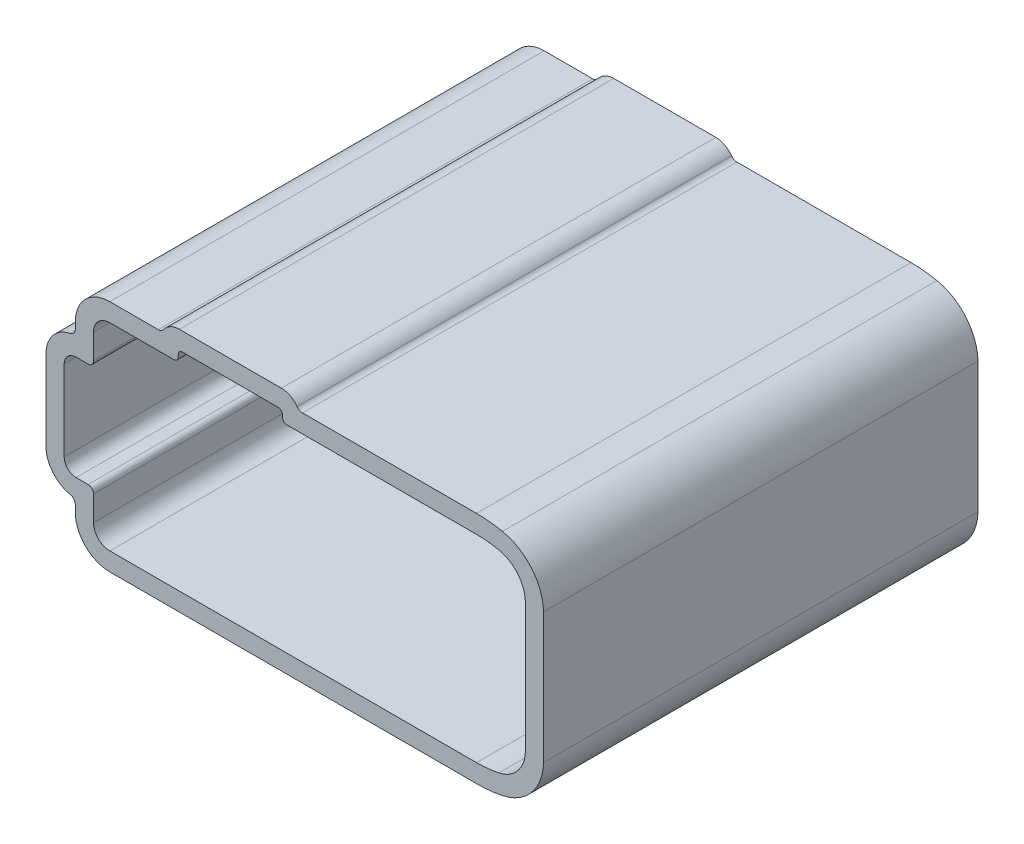
from build123d import *

# Parameters (mm, degrees)
BOSS_EXTRUDE1_DEPTH = 50.8
FILLET1_R           = 0.762


with BuildPart() as part:
    # Sketch1 → Boss-Extrude1 (new body)
    with BuildSketch(Plane.XY):
        with BuildLine():
            Line((0.921, -2.954280738), (0.921, -1.524))
            ThreePointArc((0.921, -1.524), (2.101945458, 1.327054542), (4.953, 2.508))
            Line((4.953, 2.508), (11.053129195, 2.508))
            ThreePointArc((11.053129195, 2.508), (11.884634671, 3.434294742), (13.081, 3.778))
            Line((13.081, 3.778), (25.019, 3.778))
            ThreePointArc((25.019, 3.778), (26.215365329, 3.434294742), (27.046870805, 2.508))
            Line((27.046870805, 2.508), (47.830933704, 2.508))
            ThreePointArc((47.830933704, 2.508), (49.356721017, 2.431266869), (50.867111376, 2.201841804))
            ThreePointArc((50.867111376, 2.201841804), (54.276645107, 0.167640195), (55.671506067, -3.549517234))
            Line((55.671506067, -3.549517234), (55.671506067, -18.802482766))
            ThreePointArc((55.671506067, -18.802482766), (54.276645107, -22.519640195), (50.867111376, -24.553841804))
            ThreePointArc((50.867111376, -24.553841804), (49.356721017, -24.783266869), (47.830933704, -24.86))
            Line((47.830933704, -24.86), (4.953, -24.86))
            ThreePointArc((4.953, -24.86), (2.101945458, -23.679054542), (0.921, -20.828))
            Line((0.921, -20.828), (0.921, -19.397719262))
            ThreePointArc((0.921, -19.397719262), (-1.509208506, -18.333027258), (-2.508, -15.875))
            Line((-2.508, -15.875), (-2.508, -6.477))
            ThreePointArc((-2.508, -6.477), (-1.509208506, -4.018972742), (0.921, -2.954280738))
        make_face()
        with BuildLine():
            Line((12.954, 0.889), (12.954, 1.143))
            ThreePointArc((12.954, 1.143), (13.102789755, 1.502210245), (13.462, 1.651))
            Line((13.462, 1.651), (24.638, 1.651))
            ThreePointArc((24.638, 1.651), (24.997210245, 1.502210245), (25.146, 1.143))
            Line((25.146, 1.143), (25.146, 0.889))
            ThreePointArc((25.146, 0.889), (25.294789755, 0.529789755), (25.654, 0.381))
            Line((25.654, 0.381), (47.830933704, 0.381))
            ThreePointArc((47.830933704, 0.381), (49.143323488, 0.314998811), (50.442469746, 0.117661273))
            ThreePointArc((50.442469746, 0.117661273), (52.637548133, -1.187962697), (53.544506067, -3.575524294))
            Line((53.544506067, -3.575524294), (53.544506067, -18.776475706))
            ThreePointArc((53.544506067, -18.776475706), (52.637548133, -21.164037303), (50.442469746, -22.469661273))
            ThreePointArc((50.442469746, -22.469661273), (49.143323488, -22.666998811), (47.830933704, -22.733))
            Line((47.830933704, -22.733), (4.953, -22.733))
            ThreePointArc((4.953, -22.733), (3.605961582, -22.175038418), (3.048, -20.828))
            Line((3.048, -20.828), (3.048, -17.907))
            ThreePointArc((3.048, -17.907), (2.862012806, -17.457987194), (2.413, -17.272))
            Line((2.413, -17.272), (1.016, -17.272))
            ThreePointArc((1.016, -17.272), (0.028171827, -16.862828173), (-0.381, -15.875))
            Line((-0.381, -15.875), (-0.381, -6.477))
            ThreePointArc((-0.381, -6.477), (0.028171827, -5.489171827), (1.016, -5.08))
            Line((1.016, -5.08), (2.413, -5.08))
            ThreePointArc((2.413, -5.08), (2.862012806, -4.894012806), (3.048, -4.445))
            Line((3.048, -4.445), (3.048, -1.524))
            ThreePointArc((3.048, -1.524), (3.605961582, -0.176961582), (4.953, 0.381))
            Line((4.953, 0.381), (12.446, 0.381))
            ThreePointArc((12.446, 0.381), (12.805210245, 0.529789755), (12.954, 0.889))
        make_face(mode=Mode.SUBTRACT)
    extrude(amount=BOSS_EXTRUDE1_DEPTH)

    # Fillet1
    fillet1_edges = [part.edges().sort_by_distance(p)[0] for p in [
        (0.921, -2.954280738, 25.4),
        (0.921, -19.397719262, 25.4),
        (27.046870805, 2.508, 25.4),
        (11.053129195, 2.508, 25.4),
    ]]
    fillet(fillet1_edges, radius=FILLET1_R)


solid = part.part
